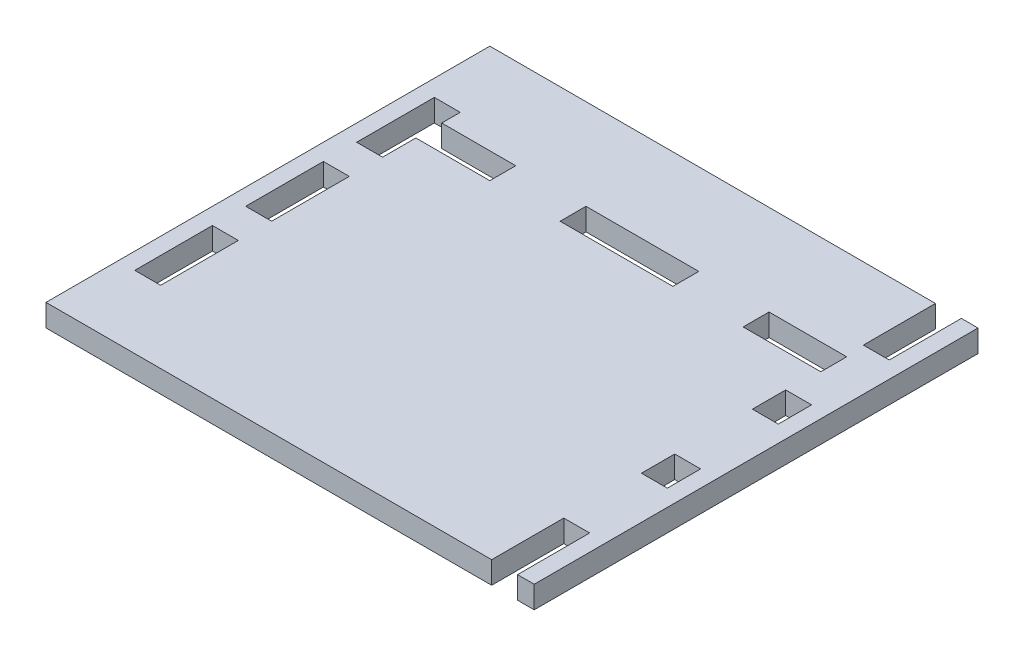
from build123d import *

# Parameters (mm, degrees)
SKETCH_3_W          = 66
SKETCH_3_H          = 60
EXTRUDE_1_DEPTH     = 3
SKETCH_1_W          = 3.5
SKETCH_1_H          = 10.5
SKETCH_1_H_2        = 9.75
SKETCH_1_H_3        = 4.5
SKETCH_1_W_2        = 15.25
SKETCH_1_H_4        = 3.5
SKETCH_1_W_3        = 10.5
CUT_EXTRUDE_1_DEPTH = 49.597691494


with BuildPart() as part:
    # Эскиз3 → Бобышка-Вытянуть1 (new body)
    with BuildSketch(Plane(origin=(0, 0, 0), x_dir=(1, 0, 0), z_dir=(0, 1, 0))):
        with Locations((0, 5.54905932)):
            Rectangle(SKETCH_3_W, SKETCH_3_H)
    extrude(amount=EXTRUDE_1_DEPTH)

    # Эскиз1 → Вырез-Вытянуть1 (cut, through all)
    with BuildSketch(Plane(origin=(0, 0, 0), x_dir=(1, 0, 0), z_dir=(0, 1, 0))):
        with Locations((-29, 5.54905932)):
            Rectangle(SKETCH_1_W, SKETCH_1_H)
        Polygon((-30.75, 25.79905932), (-27.25, 25.79905932), (-27.25, 23.29905932), (-17.25, 23.29905932), (-17.25, 19.79905932), (-27.25, 19.79905932), (-27.25, 15.29905932), (-30.75, 15.29905932), align=None)
        with Locations((-29, -9.45094068)):
            Rectangle(SKETCH_1_W, SKETCH_1_H)
        with Locations((29, -19.57594068)):
            Rectangle(SKETCH_1_W, SKETCH_1_H_2)
        with Locations((29, 13.04905932)):
            Rectangle(SKETCH_1_W, SKETCH_1_H_3)
        with Locations((29, -1.95094068)):
            Rectangle(SKETCH_1_W, SKETCH_1_H_3)
        with Locations((29, 30.67405932)):
            Rectangle(SKETCH_1_W, SKETCH_1_H_2)
        with Locations((-0.125, 21.54905932)):
            Rectangle(SKETCH_1_W_2, SKETCH_1_H_4)
        with Locations((22.25, 21.54905932)):
            Rectangle(SKETCH_1_W_3, SKETCH_1_H_4)
    extrude(amount=CUT_EXTRUDE_1_DEPTH, mode=Mode.SUBTRACT)


solid = part.part
